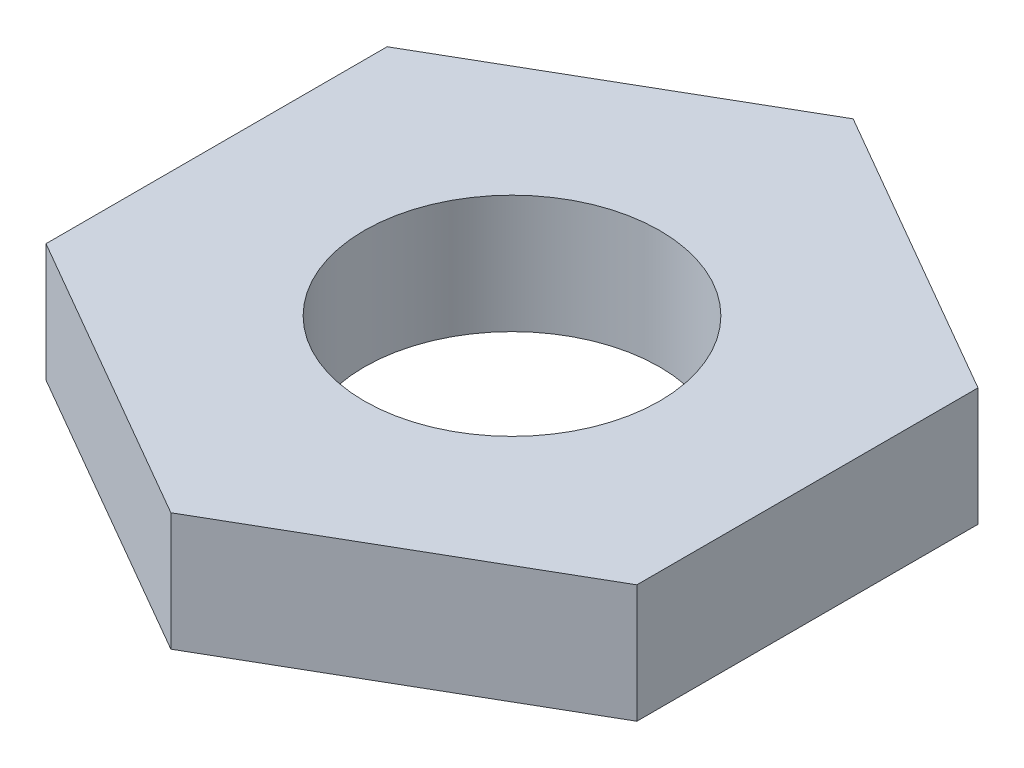
from build123d import *

# Parameters (mm, degrees)
SKETCH1_R           = 3.175
BOSS_EXTRUDE1_DEPTH = 2.54


with BuildPart() as part:
    # Sketch1 → Boss-Extrude1 (new body)
    with BuildSketch(Plane(origin=(0, 0, 0), x_dir=(1, 0, 0), z_dir=(0, 1, 0))):
        Polygon((0, 7.332348419), (-6.35, 3.666174209), (-6.35, -3.666174209), (0, -7.332348419), (6.35, -3.666174209), (6.35, 3.666174209), align=None)
        with Locations(Location((0, 0, 0), (0, 0, 270))):
            Circle(SKETCH1_R, mode=Mode.SUBTRACT)
    extrude(amount=BOSS_EXTRUDE1_DEPTH)


solid = part.part
